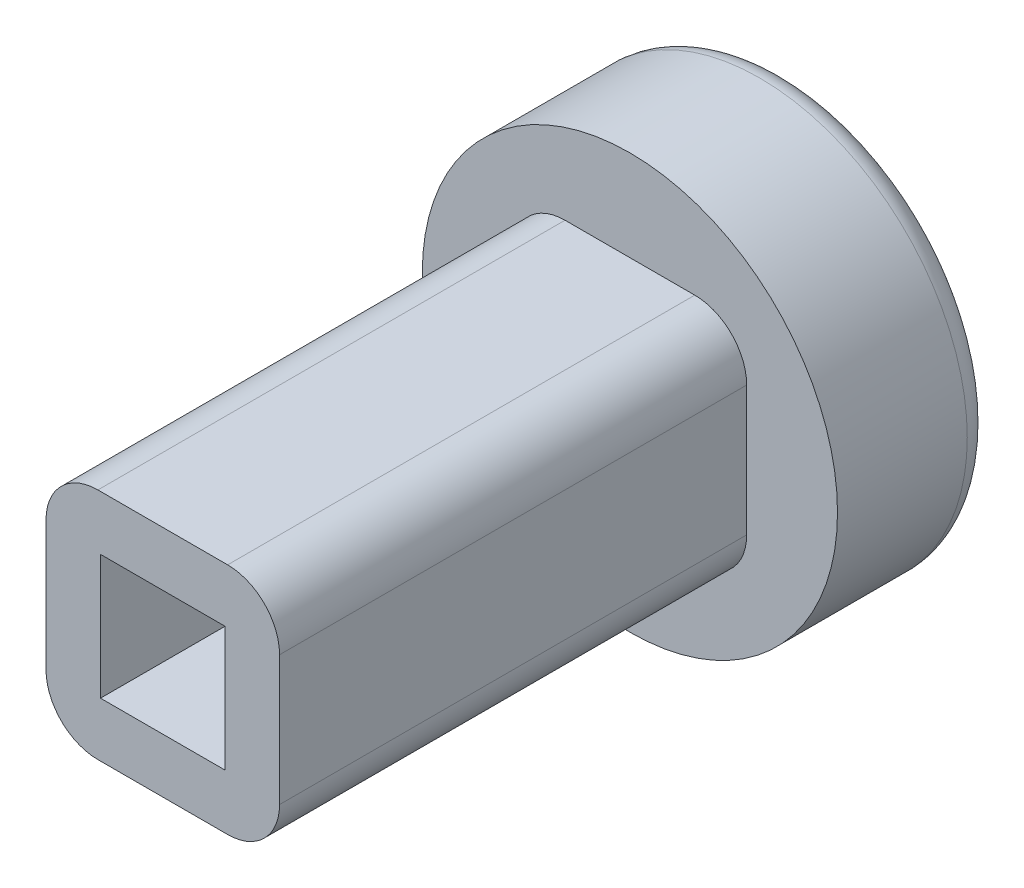
from build123d import *

# Parameters (mm, degrees)
ESQUISSE1_R             = 4
BOSS_EXTRU_1_DEPTH      = 3
ESQUISSE2_W             = 4.5
ESQUISSE2_H             = 4.5
BOSS_EXTRU_2_DEPTH      = 9
ESQUISSE3_W             = 2.4
ESQUISSE3_H             = 2.4
ENL_V_MAT_EXTRU_1_DEPTH = 3
CONG_1_R                = 1
CONG_2_R                = 0.5


with BuildPart() as part:
    # Esquisse1 → Boss.-Extru.1 (new body)
    with BuildSketch(Plane.XY):
        Circle(ESQUISSE1_R)
    extrude(amount=BOSS_EXTRU_1_DEPTH)

    # Esquisse2 → Boss.-Extru.2 (add)
    with BuildSketch(Plane.XY.offset(3)):
        Rectangle(ESQUISSE2_W, ESQUISSE2_H)
    extrude(amount=BOSS_EXTRU_2_DEPTH)

    # Esquisse3 → Enlèv. mat.-Extru.1 (cut)
    with BuildSketch(Plane.XY.offset(12)):
        Rectangle(ESQUISSE3_W, ESQUISSE3_H)
    extrude(amount=-ENL_V_MAT_EXTRU_1_DEPTH, mode=Mode.SUBTRACT)

    # Congé1
    cong_1_edges = [part.edges().sort_by_distance(p)[0] for p in [
        (-2.25, 2.25, 7.5),
        (-2.25, -2.25, 7.5),
        (2.25, -2.25, 7.5),
        (2.25, 2.25, 7.5),
    ]]
    fillet(cong_1_edges, radius=CONG_1_R)

    # Congé2
    cong_2_edges = [part.edges().sort_by_distance(p)[0] for p in [
        (-4, 0, 0),
    ]]
    fillet(cong_2_edges, radius=CONG_2_R)


solid = part.part
